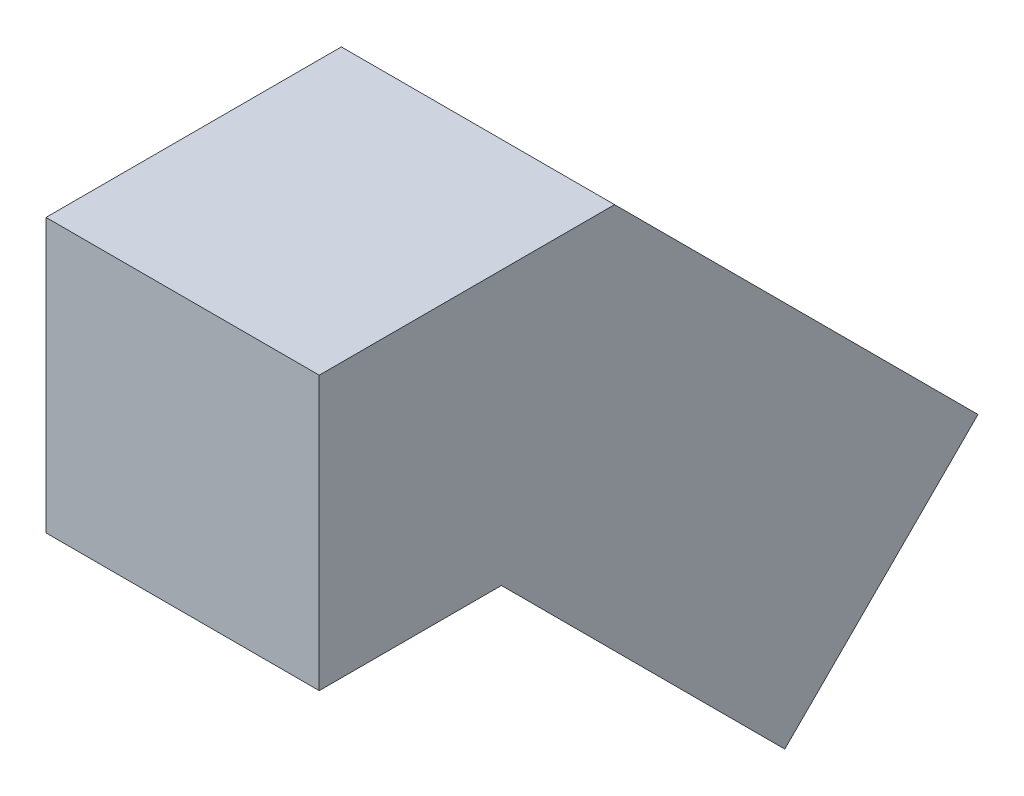
from build123d import *

# Parameters (mm, degrees)
BOSS_EXTRUDE1_DEPTH = 150


with BuildPart() as part:
    # Sketch2 → Boss-Extrude1 (new body)
    with BuildSketch(Plane(origin=(0, 0, 0), x_dir=(0, 0, -1), z_dir=(1, 0, 0))):
        Polygon((0, 0), (0, 150), (162.132034356, 150), (361.629509039, -49.497474683), (255.563491861, -155.563491861), (100, 0), align=None)
    extrude(amount=BOSS_EXTRUDE1_DEPTH)


solid = part.part
